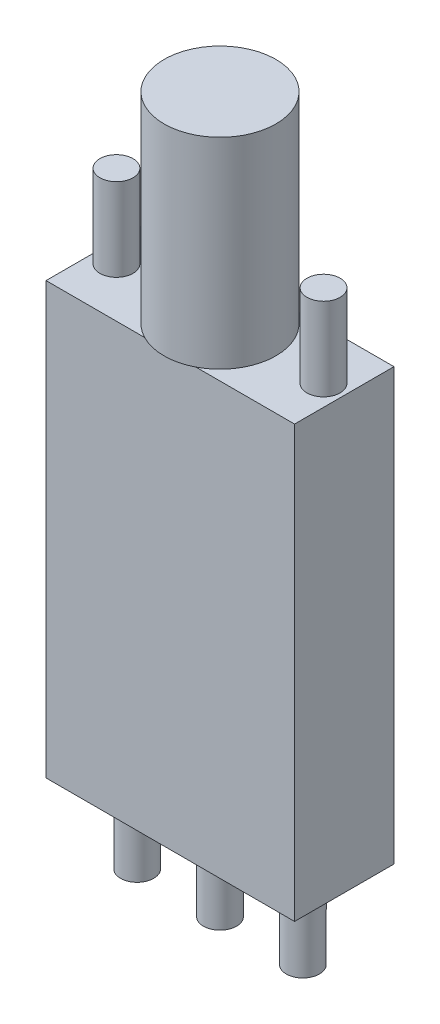
from build123d import *

# Parameters (mm, degrees)
SKETCH1_W           = 15
SKETCH1_H           = 26
BOSS_EXTRUDE1_DEPTH = 6
SKETCH2_R           = 1
BOSS_EXTRUDE2_DEPTH = 5
SKETCH3_R           = 1
BOSS_EXTRUDE3_DEPTH = 5
SKETCH5_R           = 3.375
BOSS_EXTRUDE4_DEPTH = 12.125


with BuildPart() as part:
    # Sketch1 → Boss-Extrude1 (new body)
    with BuildSketch(Plane.XY):
        Rectangle(SKETCH1_W, SKETCH1_H)
    extrude(amount=BOSS_EXTRUDE1_DEPTH)

    # Sketch2 → Boss-Extrude2 (add)
    with BuildSketch(Plane(origin=(0, 13, 0), x_dir=(1, 0, 0), z_dir=(0, 1, 0))):
        with Locations(Location((-6.25, -3, 0), (0, 0, 90))):
            Circle(SKETCH2_R)
        with Locations(Location((6.25, -3, 0), (0, 0, 90))):
            Circle(SKETCH2_R)
    extrude(amount=BOSS_EXTRUDE2_DEPTH)

    # Sketch3 → Boss-Extrude3 (add)
    with BuildSketch(Plane.XZ.offset(13)):
        with Locations(Location((0, 3, 0), (0, 0, 90))):
            Circle(SKETCH3_R)
        with Locations(Location((5, 3, 0), (0, 0, 90))):
            Circle(SKETCH3_R)
        with Locations(Location((-5, 3, 0), (0, 0, 90))):
            Circle(SKETCH3_R)
    extrude(amount=BOSS_EXTRUDE3_DEPTH)

    # Sketch5 → Boss-Extrude4 (add)
    with BuildSketch(Plane(origin=(0, 13, 0), x_dir=(1, 0, 0), z_dir=(0, 1, 0))):
        with Locations(Location((0, -3, 0), (0, 0, 62.733955549))):
            Circle(SKETCH5_R)
    extrude(amount=BOSS_EXTRUDE4_DEPTH)


solid = part.part
